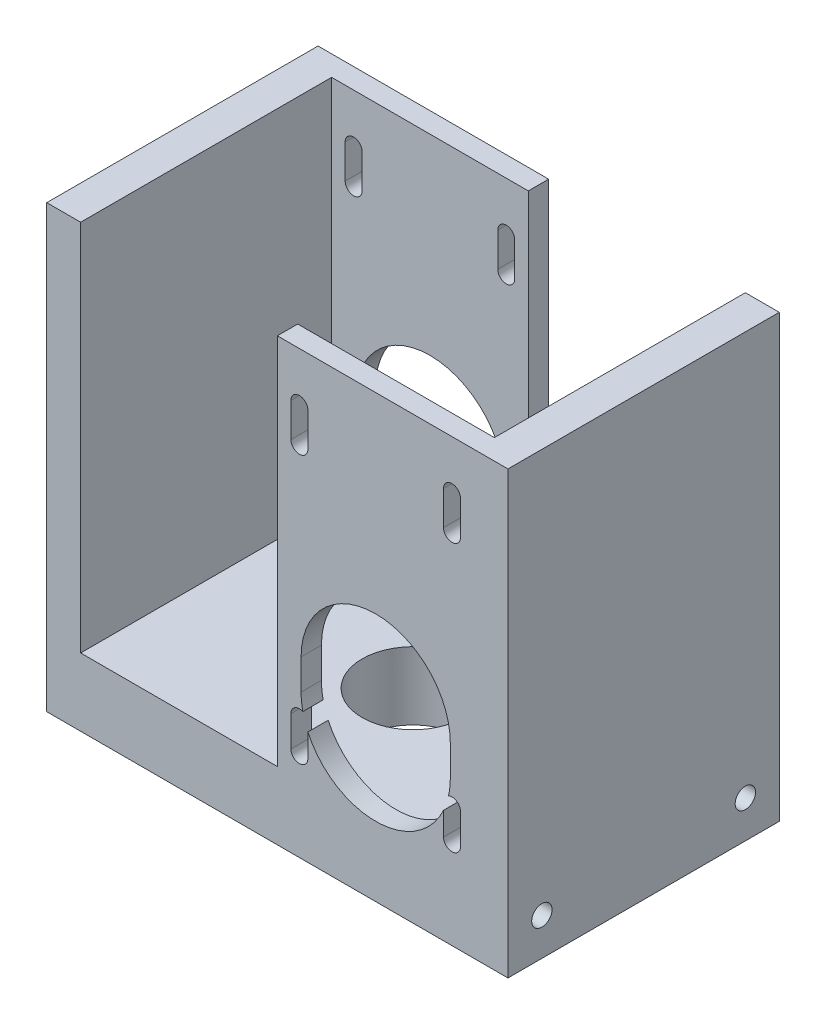
from build123d import *

# Parameters (mm, degrees)
BOSS_EXTRUDE1_DEPTH      = 20
BOSS_EXTRUDE1_DEPTH_BACK = 20
SKETCH2_W                = 29
SKETCH2_H                = 3
BOSS_EXTRUDE2_DEPTH      = 55
SKETCH4_R                = 7.5
CUT_EXTRUDE2_DEPTH       = 12
SKETCH5_R                = 1.5
CUT_EXTRUDE3_DEPTH       = 93.86549413
CUT_EXTRUDE1_DEPTH       = 63


with BuildPart() as part:
    # Sketch1 → Boss-Extrude1 (new, two sides: drawn at the far end of the back side and taken through both)
    with BuildSketch(Plane.XY.offset(-BOSS_EXTRUDE1_DEPTH_BACK)):
        Polygon((-34, -5), (34, -5), (34, 60), (29, 60), (29, 5), (-29, 5), (-29, 60), (-34, 60), align=None)
    extrude(amount=BOSS_EXTRUDE1_DEPTH + BOSS_EXTRUDE1_DEPTH_BACK)

    # Sketch2 → Boss-Extrude2 (add)
    with BuildSketch(Plane(origin=(0, 5, 0), x_dir=(1, 0, 0), z_dir=(0, 1, 0))):
        with Locations((14.5, -18.5)):
            Rectangle(SKETCH2_W, SKETCH2_H)
        with Locations((-14.5, 18.5)):
            Rectangle(SKETCH2_W, SKETCH2_H)
    extrude(amount=BOSS_EXTRUDE2_DEPTH)

    # Sketch4 → Cut-Extrude2 (cut)
    with BuildSketch(Plane(origin=(0, 5, 0), x_dir=(1, 0, 0), z_dir=(0, 1, 0))):
        Circle(SKETCH4_R)
    extrude(amount=-CUT_EXTRUDE2_DEPTH, mode=Mode.SUBTRACT)

    # Sketch5 → Cut-Extrude3 (cut, through all)
    with BuildSketch(Plane(origin=(34, 0, 0), x_dir=(0, 0, -1), z_dir=(1, 0, 0))):
        with Locations((-15, 0.5)):
            Circle(SKETCH5_R)
        with Locations((15, 0.5)):
            Circle(SKETCH5_R)
    extrude(amount=-CUT_EXTRUDE3_DEPTH, mode=Mode.SUBTRACT)

    # Sketch3 → Cut-Extrude1 (cut)
    with BuildSketch(Plane(origin=(0, 0, -20), x_dir=(-1, 0, 0), z_dir=(0, 0, -1))):
        with BuildLine():
            ThreePointArc((3.755430717, 13.893258409), (2.567830079, 13.797446513), (2, 12.75))
            Line((2, 12.75), (2, 8.25))
            ThreePointArc((2, 8.25), (3.25, 7), (4.5, 8.25))
            Line((4.5, 8.25), (4.5, 11.667424305))
            ThreePointArc((4.5, 11.667424305), (14.5, 5.25), (24.5, 11.667424305))
            Line((24.5, 11.667424305), (24.5, 8.25))
            ThreePointArc((24.5, 8.25), (25.75, 7), (27, 8.25))
            Line((27, 8.25), (27, 12.75))
            ThreePointArc((27, 12.75), (26.432169921, 13.797446513), (25.244569283, 13.893258409))
            ThreePointArc((25.244569283, 13.893258409), (25.435955882, 15.064728325), (25.5, 16.25))
            Line((25.5, 16.25), (25.5, 20.75))
            ThreePointArc((25.5, 20.75), (14.5, 31.75), (3.5, 20.75))
            Line((3.5, 20.75), (3.5, 16.25))
            ThreePointArc((3.5, 16.25), (3.564044118, 15.064728325), (3.755430717, 13.893258409))
        make_face()
        with BuildLine():
            ThreePointArc((4.5, 52.75), (3.25, 54), (2, 52.75))
            Line((2, 52.75), (2, 47.75))
            ThreePointArc((2, 47.75), (3.25, 46.5), (4.5, 47.75))
            Line((4.5, 47.75), (4.5, 52.75))
        make_face()
        with BuildLine():
            ThreePointArc((27, 52.75), (25.75, 54), (24.5, 52.75))
            Line((24.5, 52.75), (24.5, 47.75))
            ThreePointArc((24.5, 47.75), (25.75, 46.5), (27, 47.75))
            Line((27, 47.75), (27, 52.75))
        make_face()
    cut_extrude1 = extrude(amount=-CUT_EXTRUDE1_DEPTH, mode=Mode.SUBTRACT)

    # Mirror4: Cut-Extrude1 across plane
    add(cut_extrude1.mirror(Plane(origin=(0, 0, 0), x_dir=(0, 0, 1), z_dir=(1, 0, 0))), mode=Mode.SUBTRACT)


solid = part.part
